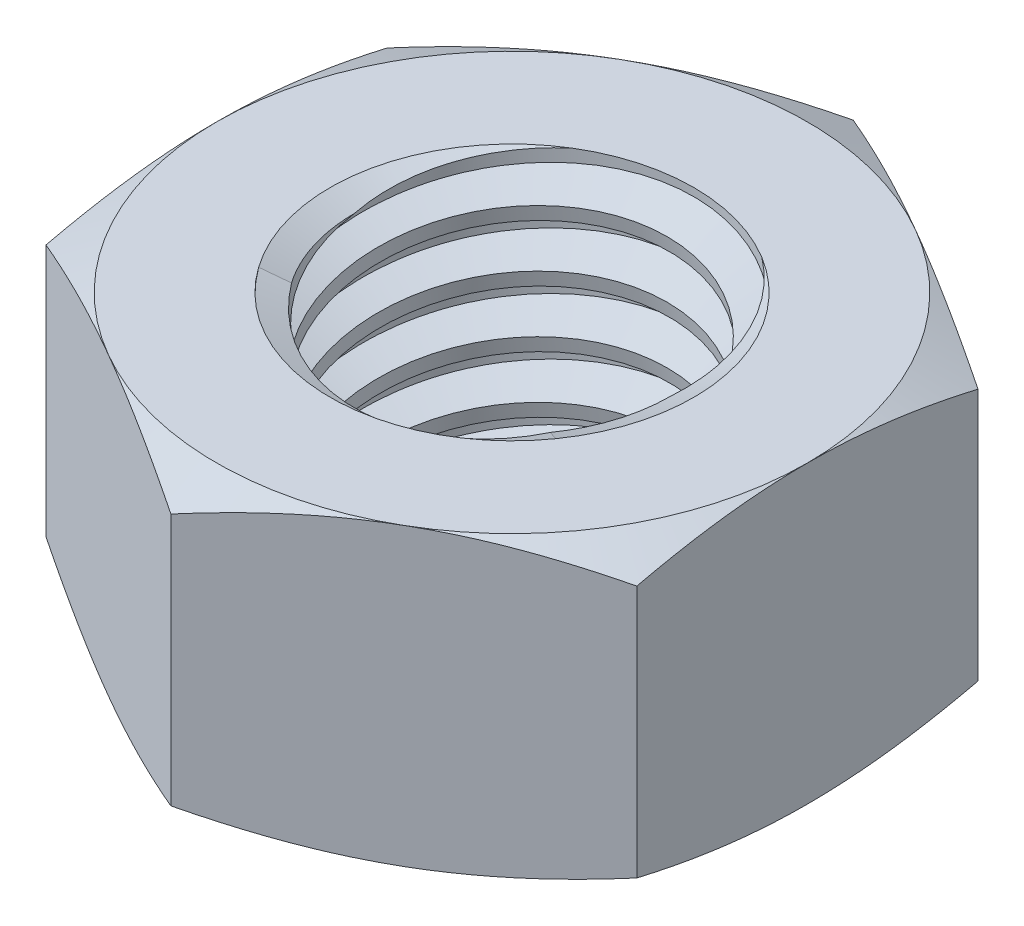
from build123d import *

# Parameters (mm, degrees)
EXTRUDE1_DEPTH      = 3.25
SKETCH2_W           = 4
SKETCH2_H           = 6.5
LPATTERN1_COUNT     = 5
LPATTERN1_PITCH     = 1.25
LPATTERN1_COL_COUNT = 2
LPATTERN1_COL_PITCH = 1.25


with BuildPart() as part:
    # Sketch1 → Extrude1 (new, symmetric)
    with BuildSketch(Plane(origin=(0, 0, 0), x_dir=(1, 0, 0), z_dir=(0, 1, 0))):
        Polygon((0, 7.505553499), (-6.5, 3.75277675), (-6.5, -3.75277675), (0, -7.505553499), (6.5, -3.75277675), (6.5, 3.75277675), align=None)
    extrude(amount=EXTRUDE1_DEPTH, both=True)

    # Sketch4 → Cut-Revolve2 (revolve, cut)
    with BuildSketch(Plane(origin=(0, 0, 0), x_dir=(0, 0, -1), z_dir=(1, 0, 0)), mode=Mode.PRIVATE) as cut_revolve2_sk:
        Polygon((0, 3.25), (4, 3.25), (3.415953356, 2.977654577), (3.415953356, -2.977654577), (4, -3.25), (0, -3.25), align=None)
    revolve(cut_revolve2_sk.sketch.rotate(Axis((0, 3.25, 0), (0, 1, 0)), 55.056269787), axis=Axis((0, 3.25, 0), (0, 1, 0)), mode=Mode.SUBTRACT)


with BuildPart() as body_2:
    # Sketch2 → Revolve1 (revolve)
    with BuildSketch(Plane(origin=(0, 0, 0), x_dir=(0, 0, -1), z_dir=(1, 0, 0))):
        with Locations((2, 0)):
            Rectangle(SKETCH2_W, SKETCH2_H)
    revolve(axis=Axis((0, -7.25, 0), (0, 1, 0)))

    # Sketch3 → Cut-Revolve1 (revolve, cut)
    with BuildSketch(Plane(origin=(0, 0, 0), x_dir=(0, 0, -1), z_dir=(1, 0, 0)), mode=Mode.PRIVATE) as cut_revolve1_sk:
        Polygon((4.024121388, 3.09562312), (4.1929711, 2.014984958), (3.464196131, 2.296478487), (3.415953356, 2.605232247), align=None)
    cut_revolve1 = revolve(cut_revolve1_sk.sketch.rotate(Axis((0, 3.25, 0.208852549), (0, -0.9880120337511015, -0.15437688027360985)), 180), axis=Axis((0, 3.25, 0.208852549), (0, -0.9880120337511015, -0.15437688027360985)), mode=Mode.SUBTRACT)

    # LPattern1: Cut-Revolve1 ×5
    with Locations(*[(0, -i * LPATTERN1_PITCH, 0) for i in range(1, LPATTERN1_COUNT)]):
        add(cut_revolve1, mode=Mode.SUBTRACT)

    # LPattern1 col: Cut-Revolve1 ×2
    with Locations(*[(0, i * LPATTERN1_COL_PITCH, 0) for i in range(1, LPATTERN1_COL_COUNT)]):
        add(cut_revolve1, mode=Mode.SUBTRACT)


with BuildPart() as part_1:
    add(part.part)

    # Combine1: cut body 2
    add(body_2.part, mode=Mode.SUBTRACT)

    # Sketch5 → Cut-Revolve3 (revolve, cut)
    with BuildSketch(Plane(origin=(0, 0, 0), x_dir=(0, 0, -1), z_dir=(1, 0, 0)), mode=Mode.PRIVATE) as cut_revolve3_sk:
        Polygon((0, -3.25), (6.5, -3.25), (7.505553499, -2.781102703), (7.505553499, 2.781102703), (6.5, 3.25), (0, 3.25), (0, 4.52), (8.775553499, 4.52), (8.775553499, -4.52), (0, -4.52), align=None)
    revolve(cut_revolve3_sk.sketch.rotate(Axis((0, -3.25, 0), (0, 1, 0)), 55.056269787), axis=Axis((0, -3.25, 0), (0, 1, 0)), mode=Mode.SUBTRACT)


solid = part_1.part
